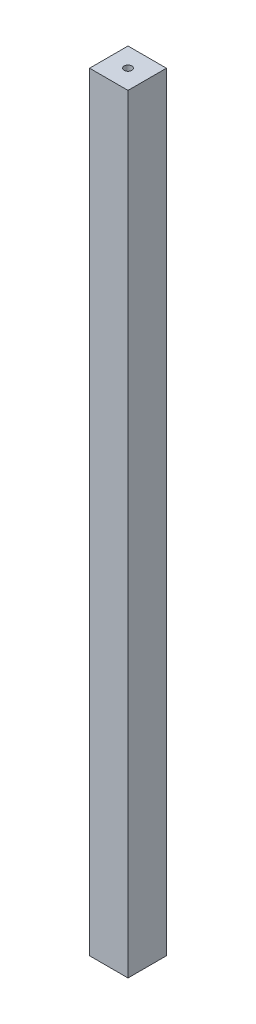
from build123d import *

# Parameters (mm, degrees)
SKETCH_1_W          = 50
SKETCH_1_H          = 50
EXTRUDE_2_DEPTH     = 900
SKETCH_4_R          = 5
CUT_EXTRUDE_2_DEPTH = 50
CUT_EXTRUDE_START   = -50
SKETCH_5_R          = 5
CUT_EXTRUDE_3_DEPTH = 50
SKETCH_6_W          = 50
SKETCH_6_H          = 50
EXTRUDE_3_DEPTH     = 100
CUT_EXTRUDE_START_2 = -100
SKETCH_7_R          = 5
CUT_EXTRUDE_4_DEPTH = 100


with BuildPart() as part:
    # Эскиз1 → Бобышка-Вытянуть2 (new body)
    with BuildSketch(Plane(origin=(0, 0, 0), x_dir=(1, 0, 0), z_dir=(0, 1, 0))):
        Rectangle(SKETCH_1_W, SKETCH_1_H)
    extrude(amount=EXTRUDE_2_DEPTH)

    # Эскиз4 → Вырез-Вытянуть2 (cut)
    with BuildSketch(Plane(origin=(0, 900, 0), x_dir=(1, 0, 0), z_dir=(0, 1, 0))):
        with Locations(Location((0, 0, 0), (0, 0, 270))):
            Circle(SKETCH_4_R)
    extrude(amount=-CUT_EXTRUDE_2_DEPTH, mode=Mode.SUBTRACT)

    # Эскиз5 → Вырез-Вытянуть3 (cut)
    with BuildSketch(Plane.XZ.offset(CUT_EXTRUDE_START)):
        with Locations(Location((0, 0, 0), (0, 0, 90))):
            Circle(SKETCH_5_R)
    extrude(amount=CUT_EXTRUDE_3_DEPTH, mode=Mode.SUBTRACT)

    # Эскиз6 → Бобышка-Вытянуть3 (add)
    with BuildSketch(Plane.XZ):
        Rectangle(SKETCH_6_W, SKETCH_6_H)
    extrude(amount=EXTRUDE_3_DEPTH)

    # Эскиз7 → Вырез-Вытянуть4 (cut)
    with BuildSketch(Plane.XZ.offset(100).offset(CUT_EXTRUDE_START_2)):
        with Locations(Location((0, 0, 0), (0, 0, 270))):
            Circle(SKETCH_7_R)
    extrude(amount=CUT_EXTRUDE_4_DEPTH, mode=Mode.SUBTRACT)


solid = part.part
